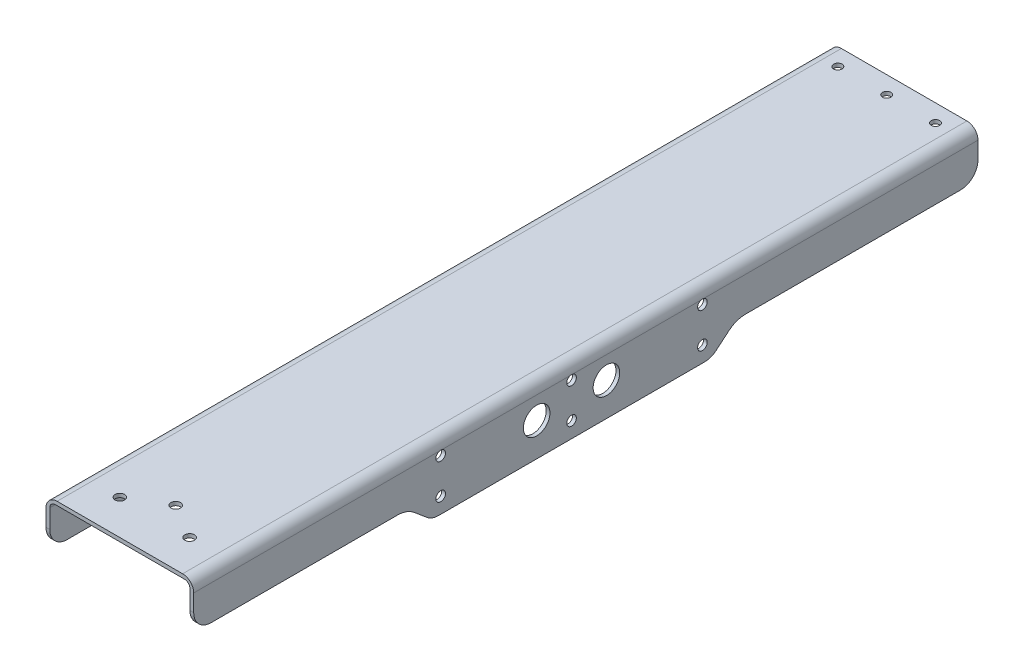
from build123d import *

# Parameters (mm, degrees)
BOSS_EXTRUDE1_DEPTH         = 224.75
F_11_0_191_DIAMETER_HOLE1_D = 4.8514
M5_CLEARANCE_HOLE2_D        = 5.5
M5_CLEARANCE_HOLE1_D        = 5.5
SKETCH11_R                  = 7.625
CUT_EXTRUDE1_DEPTH          = 244.169042699
FILLET1_R                   = 3.175
FILLET2_R                   = 6.35
CUT_EXTRUDE3_DEPTH          = 244.169042826
FILLET3_R                   = 10


with BuildPart() as part:
    # Sketch1 → Boss-Extrude1 (new, symmetric)
    with BuildSketch(Plane.XY):
        Polygon((42.3291, -38.1), (42.3291, 0), (-42.3291, 0), (-42.3291, -38.1), (-40.1701, -38.1), (-40.1701, -2.159), (40.1701, -2.159), (40.1701, -38.1), align=None)
    extrude(amount=BOSS_EXTRUDE1_DEPTH, both=True)

    # #11 (0.191) Diameter Hole1 (through all)
    with Locations(Plane(origin=(0, 0, 0), x_dir=(1, 0, 0), z_dir=(0, 1, 0))):
        with Locations((28, 214.75), (-28, 214.75), (0, 214.75)):
            Hole(F_11_0_191_DIAMETER_HOLE1_D / 2)

    # M5 Clearance Hole2 (through all)
    with Locations(Plane(origin=(0, 0, 0), x_dir=(-1, 0, 0), z_dir=(0, 1, 0))):
        with Locations((0, 192.75), (-20, 204.75), (20, 204.75)):
            Hole(M5_CLEARANCE_HOLE2_D / 2)

    # M5 Clearance Hole1 (through all)
    with Locations(Plane(origin=(-42.3291, 0, 0), x_dir=(0, 0, -1), z_dir=(-1, 0, 0))):
        with Locations((66.8, 29.1), (66.8, 9), (-8.2, 29.1), (-8.2, 9), (-83.2, 29.1), (-83.2, 9)):
            Hole(M5_CLEARANCE_HOLE1_D / 2)

    # Sketch11 → Cut-Extrude1 (cut, through all)
    with BuildSketch(Plane(origin=(-42.3291, 0, 0), x_dir=(0, 0, -1), z_dir=(1, 0, 0))):
        with Locations((-28.2, -19.05)):
            Circle(SKETCH11_R)
        with Locations((11.8, -19.05)):
            Circle(SKETCH11_R)
    extrude(amount=CUT_EXTRUDE1_DEPTH, mode=Mode.SUBTRACT)

    # Fillet1
    fillet1_edges = [part.edges().sort_by_distance(p)[0] for p in [
        (-40.1701, -2.159, 0),
        (40.1701, -2.159, 0),
    ]]
    fillet(fillet1_edges, radius=FILLET1_R)

    # Fillet2
    fillet2_edges = [part.edges().sort_by_distance(p)[0] for p in [
        (-42.3291, 0, 0),
        (42.3291, 0, 0),
    ]]
    fillet(fillet2_edges, radius=FILLET2_R)

    # Sketch13 → Cut-Extrude3 (cut, through all)
    with BuildSketch(Plane.ZY.offset(42.3291)):
        with BuildLine():
            Line((-71.8, -38.1), (-81.91878248, -29.609333353))
            ThreePointArc((-81.91878248, -29.609333353), (-86.430294475, -27.004610688), (-91.560596625, -26.1))
            Line((-91.560596625, -26.1), (-224.75, -26.1))
            Line((-224.75, -26.1), (-224.75, -38.1))
            Line((-224.75, -38.1), (-71.8, -38.1))
        make_face()
        with BuildLine():
            Line((88.2, -38.1), (224.75, -38.1))
            Line((224.75, -38.1), (224.75, -26.1))
            Line((224.75, -26.1), (107.960596625, -26.1))
            ThreePointArc((107.960596625, -26.1), (102.830294475, -27.004610688), (98.31878248, -29.609333353))
            Line((98.31878248, -29.609333353), (88.2, -38.1))
        make_face()
    extrude(amount=-CUT_EXTRUDE3_DEPTH, mode=Mode.SUBTRACT)

    # Fillet3
    fillet3_edges = [part.edges().sort_by_distance(p)[0] for p in [
        (-41.2496, -38.1, -71.8),
        (41.2496, -38.1, -71.8),
        (41.2496, -38.1, 88.2),
        (-41.2496, -38.1, 88.2),
        (-41.2496, -26.1, -224.75),
        (41.2496, -26.1, -224.75),
        (-41.2496, -26.1, 224.75),
        (41.2496, -26.1, 224.75),
    ]]
    fillet(fillet3_edges, radius=FILLET3_R)


solid = part.part
